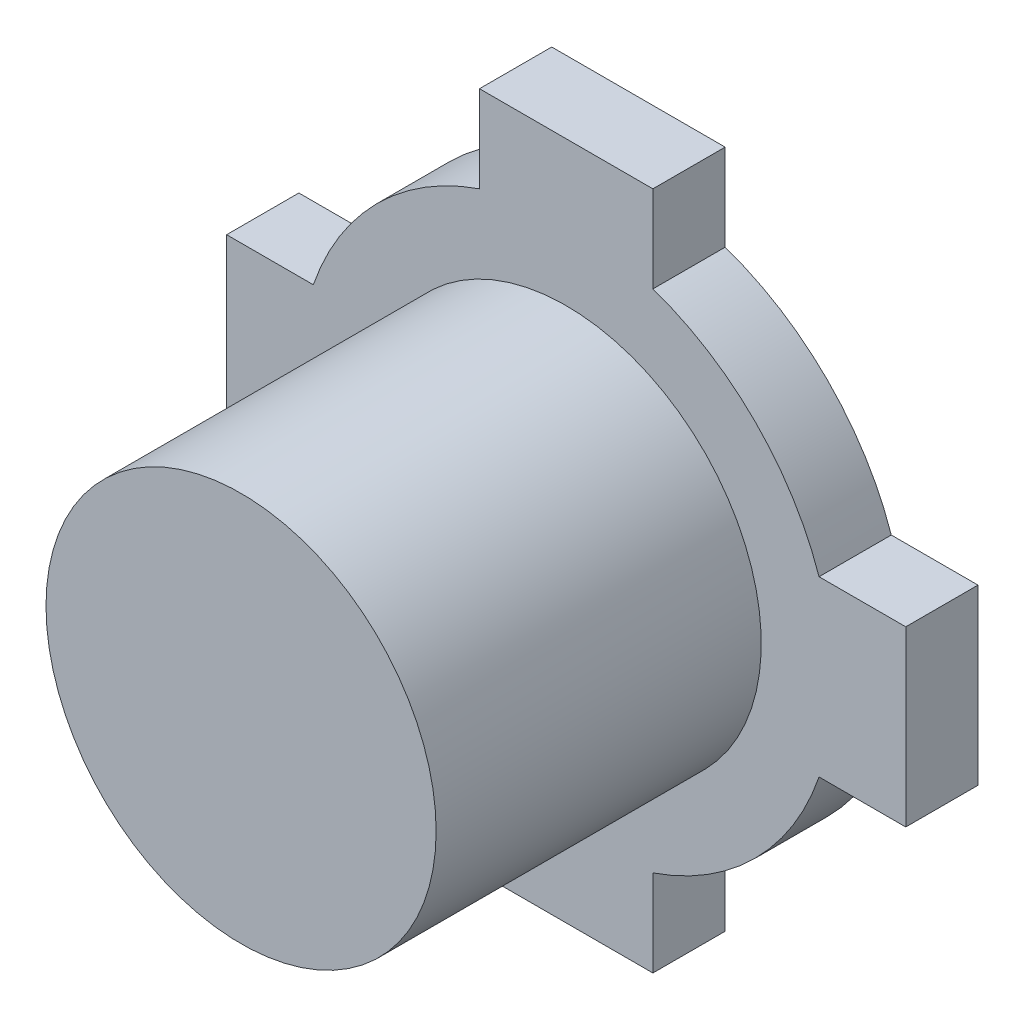
from build123d import *

# Parameters (mm, degrees)
SKETCH1_R           = 2.7
BOSS_EXTRUDE1_DEPTH = 4.5
BOSS_EXTRUDE2_DEPTH = 1


with BuildPart() as part:
    # Sketch1 → Boss-Extrude1 (new body)
    with BuildSketch(Plane.XY):
        Circle(SKETCH1_R)
    extrude(amount=BOSS_EXTRUDE1_DEPTH)

    # Sketch2 → Boss-Extrude2 (add)
    with BuildSketch(Plane(origin=(0, 0, 0), x_dir=(-1, 0, 0), z_dir=(0, 0, -1))):
        with BuildLine():
            Line((-3.5, 1.2), (-4.7, 1.2))
            Line((-4.7, 1.2), (-4.7, -1.2))
            Line((-4.7, -1.2), (-3.5, -1.2))
            ThreePointArc((-3.5, -1.2), (-2.61629509, -2.61629509), (-1.2, -3.5))
            Line((-1.2, -3.5), (-1.2, -4.7))
            Line((-1.2, -4.7), (1.2, -4.7))
            Line((1.2, -4.7), (1.2, -3.5))
            ThreePointArc((1.2, -3.5), (2.61629509, -2.61629509), (3.5, -1.2))
            Line((3.5, -1.2), (4.7, -1.2))
            Line((4.7, -1.2), (4.7, 1.2))
            Line((4.7, 1.2), (3.5, 1.2))
            ThreePointArc((3.5, 1.2), (2.61629509, 2.61629509), (1.2, 3.5))
            Line((1.2, 3.5), (1.2, 4.7))
            Line((1.2, 4.7), (-1.2, 4.7))
            Line((-1.2, 4.7), (-1.2, 3.5))
            ThreePointArc((-1.2, 3.5), (-2.61629509, 2.61629509), (-3.5, 1.2))
        make_face()
    extrude(amount=BOSS_EXTRUDE2_DEPTH)


solid = part.part
